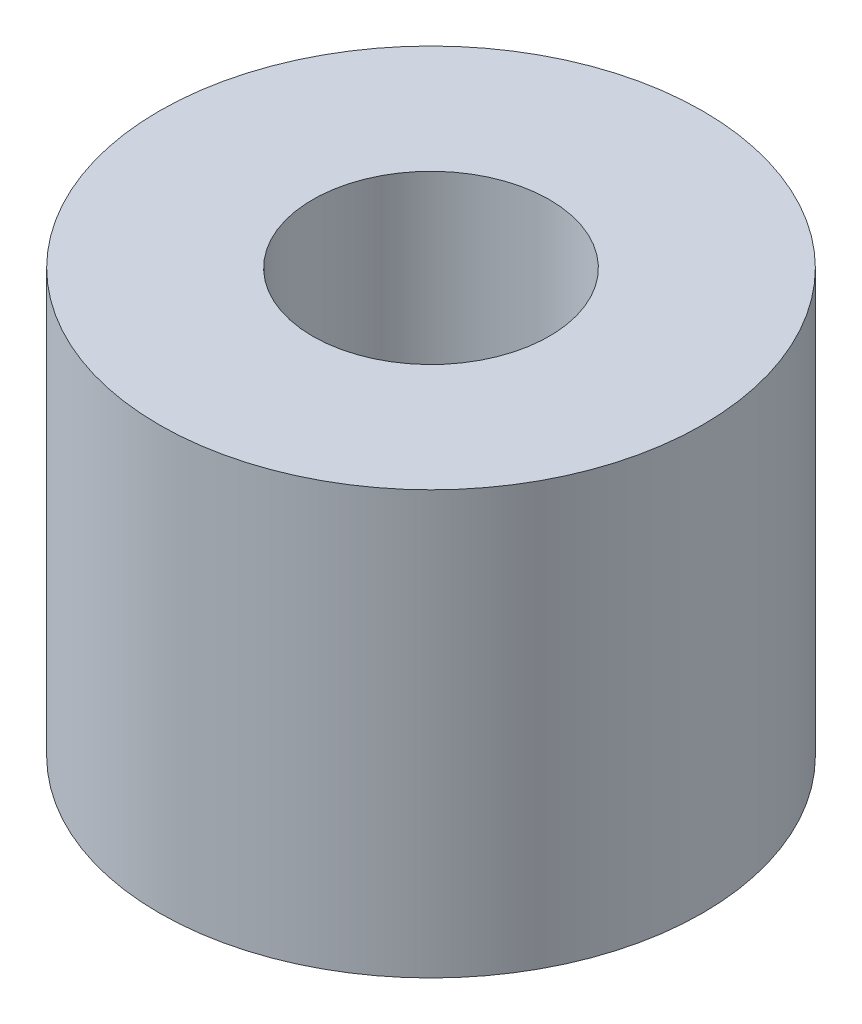
from build123d import *

# Parameters (mm, degrees)
SKETCH1_R           = 5.715
SKETCH1_R_2         = 2.4892
BOSS_EXTRUDE1_DEPTH = 8.89


with BuildPart() as part:
    # Sketch1 → Boss-Extrude1 (new body)
    with BuildSketch(Plane(origin=(0, 0, 0), x_dir=(1, 0, 0), z_dir=(0, 1, 0))):
        with Locations(Location((0, 0, 0), (0, 0, 270))):
            Circle(SKETCH1_R)
        with Locations(Location((0, 0, 0), (0, 0, 270))):
            Circle(SKETCH1_R_2, mode=Mode.SUBTRACT)
    extrude(amount=BOSS_EXTRUDE1_DEPTH)


solid = part.part
